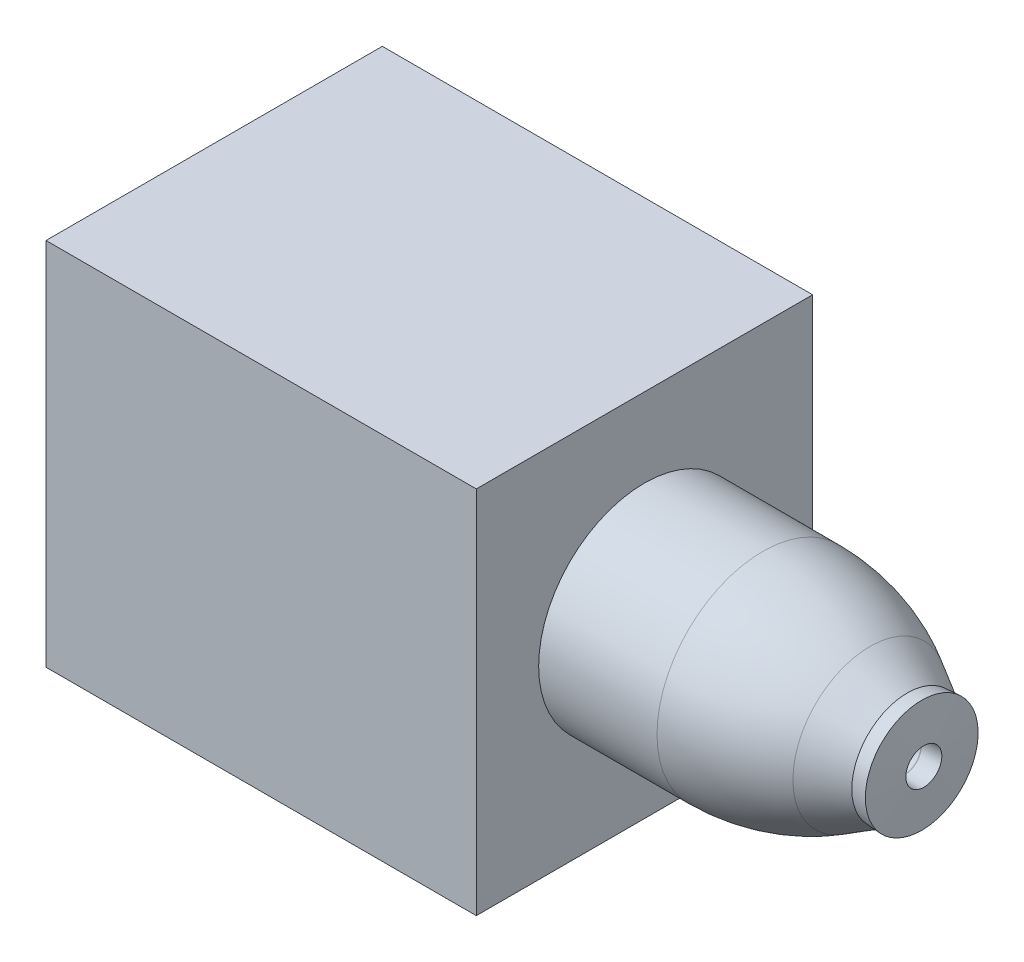
from build123d import *

# Parameters (mm, degrees)
SKETCH1_W           = 52.054588137
SKETCH1_H           = 19.540614726
BOSS_EXTRUDE1_DEPTH = 8.89
SKETCH3_W           = 29.304045921
SKETCH3_H           = 19.540614726
CUT_EXTRUDE1_DEPTH  = 70.835641623


with BuildPart() as part:
    # Model → Revolve1 (revolve)
    with BuildSketch(Plane.XY, mode=Mode.PRIVATE) as revolve1_sk:
        with BuildLine():
            add(Edge.make_bspline(
                [(65.953268304, 2.93538911), (66.613970922, 2.97512211), (66.714344102, 2.980580933)],
                knots=[0.156174428, 0.156174428, 0.156174428, 1, 1, 1], degree=2))
            Line((66.714344102, 2.980580933), (66.8238694, 0.9515348))
            add(Edge.make_bspline(
                [(65.809518177, 0.891062762), (66.723641, 0.9461246), (66.8238694, 0.9515348)],
                knots=[0, 0, 0, 1, 1, 1], degree=2))
            ThreePointArc((65.809518177, 0.891062762), (65.799300412, 0.890601575), (65.7890734, 0.8904478))
            ThreePointArc((65.7890734, 0.8904478), (65.443371388, 0.935970102), (65.1212312, 1.0694162))
            Line((65.1212312, 1.0694162), (62.962634994, 2.315661898))
            ThreePointArc((62.962634994, 2.315661898), (60.719228535, 3.244897306), (58.3117616, 3.561842))
            Line((58.3117616, 3.561842), (0, 3.561842))
            Line((0, 3.561842), (0, 5.593842))
            Line((0, 5.593842), (58.3117616, 5.593842))
            ThreePointArc((58.3117616, 5.593842), (61.245141878, 5.207660449), (63.978622519, 4.075432721))
            Line((63.978622519, 4.075432721), (65.953268304, 2.93538911))
        make_face()
    revolve(revolve1_sk.sketch.rotate(Axis((0, 0, 0), (1, 0, 0)), 90), axis=Axis((0, 0, 0), (1, 0, 0)))

    # Sketch1 → Boss-Extrude1 (add, symmetric)
    with BuildSketch(Plane.XY):
        with Locations((26.027294069, 0)):
            Rectangle(SKETCH1_W, SKETCH1_H)
    extrude(amount=BOSS_EXTRUDE1_DEPTH, both=True)

    # Sketch3 → Cut-Extrude1 (cut, through all)
    with BuildSketch(Plane.XY.offset(8.89)):
        with Locations((14.652022961, 0)):
            Rectangle(SKETCH3_W, SKETCH3_H)
    extrude(amount=-CUT_EXTRUDE1_DEPTH, mode=Mode.SUBTRACT)


solid = part.part
